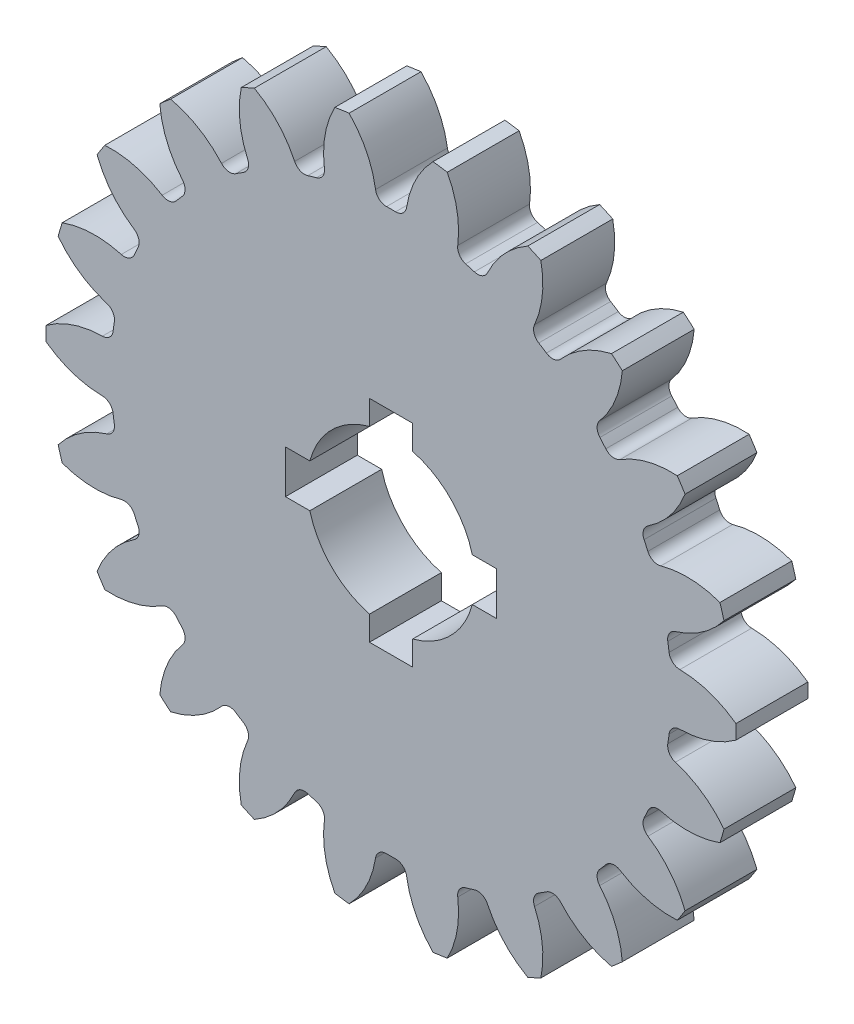
from build123d import *

# Parameters (mm, degrees)
SKETCH1_R                = 24
BOSS_EXTRUDE1_DEPTH      = 5
CUT_EXTRUDE1_DEPTH       = 10
FILLET2_R                = 0.76
CIRPATTERN2_COUNT        = 22
FILLET2_OF_CIRPATTERN2_R = 0.76
CUT_EXTRUDE2_DEPTH       = 5


with BuildPart() as part:
    # Sketch1 → Boss-Extrude1 (new body)
    with BuildSketch(Plane.XY):
        Circle(SKETCH1_R)
    extrude(amount=-BOSS_EXTRUDE1_DEPTH)

    # Sketch1<4> → Cut-Extrude1 (cut)
    with BuildSketch(Plane.XY):
        with BuildLine():
            ThreePointArc((-1.010850177, 19.473781911), (0, 19.5), (1.010850177, 19.473781911))
            ThreePointArc((1.010850177, 19.473781911), (1.567692055, 21.822368063), (2.919931026, 23.821712844))
            ThreePointArc((2.919931026, 23.821712844), (0, 24), (-2.919931026, 23.821712844))
            ThreePointArc((-2.919931026, 23.821712844), (-1.567692055, 21.822368063), (-1.010850177, 19.473781911))
        make_face()
    cut_extrude1 = extrude(amount=-CUT_EXTRUDE1_DEPTH, mode=Mode.SUBTRACT)

    # Fillet2
    fillet2_edges = [part.edges().sort_by_distance(p)[0] for p in [
        (1.010850177, 19.473781911, -2.5),
        (-1.010850177, 19.473781911, -2.5),
    ]]
    fillet(fillet2_edges, radius=FILLET2_R)

    # CirPattern2: Cut-Extrude1 ×22 about axis
    cirpattern2_axis = Axis((0, 0, 0), (0, 0, 1))
    for i in range(1, CIRPATTERN2_COUNT):
        add(cut_extrude1.rotate(cirpattern2_axis, i * 360 / CIRPATTERN2_COUNT), mode=Mode.SUBTRACT)

    # Fillet2 of CirPattern2
    fillet2_of_cirpattern2_edges = [part.edges().sort_by_distance(p)[0] for p in [
        (-4.516494727, 18.969746318, -2.5),
        (-6.456302011, 18.400167508, -2.5),
        (-9.677940089, 16.928894696, -2.5),
        (-11.378702654, 15.835880964, -2.5),
        (-14.055336302, 13.516564706, -2.5),
        (-15.379268479, 11.988665524, -2.5),
        (-17.294052757, 9.009203029, -2.5),
        (-18.133897436, 7.170199702, -2.5),
        (-19.131707911, 3.771969303, -2.5),
        (-19.41942587, 1.770846944, -2.5),
        (-19.41942587, -1.770846944, -2.5),
        (-19.131707911, -3.771969303, -2.5),
        (-18.133897436, -7.170199702, -2.5),
        (-17.294052757, -9.009203029, -2.5),
        (-15.379268479, -11.988665524, -2.5),
        (-14.055336302, -13.516564706, -2.5),
        (-11.378702654, -15.835880964, -2.5),
        (-9.677940089, -16.928894696, -2.5),
        (-6.456302011, -18.400167508, -2.5),
        (-4.516494727, -18.969746318, -2.5),
        (-1.010850177, -19.473781911, -2.5),
        (1.010850177, -19.473781911, -2.5),
        (4.516494727, -18.969746318, -2.5),
        (6.456302011, -18.400167508, -2.5),
        (9.677940089, -16.928894696, -2.5),
        (11.378702654, -15.835880964, -2.5),
        (14.055336302, -13.516564706, -2.5),
        (15.379268479, -11.988665524, -2.5),
        (17.294052757, -9.009203029, -2.5),
        (18.133897436, -7.170199702, -2.5),
        (19.131707911, -3.771969303, -2.5),
        (19.41942587, -1.770846944, -2.5),
        (19.41942587, 1.770846944, -2.5),
        (19.131707911, 3.771969303, -2.5),
        (18.133897436, 7.170199702, -2.5),
        (17.294052757, 9.009203029, -2.5),
        (15.379268479, 11.988665524, -2.5),
        (14.055336302, 13.516564706, -2.5),
        (11.378702654, 15.835880964, -2.5),
        (9.677940089, 16.928894696, -2.5),
        (6.456302011, 18.400167508, -2.5),
        (4.516494727, 18.969746318, -2.5),
    ]]
    fillet(fillet2_of_cirpattern2_edges, radius=FILLET2_OF_CIRPATTERN2_R)

    # Sketch2 → Cut-Extrude2 (cut)
    with BuildSketch(Plane.XY):
        with BuildLine():
            Line((-1.5, 5.652839314), (-1.5, 7.348469228))
            Line((-1.5, 7.348469228), (1.5, 7.348469228))
            Line((1.5, 7.348469228), (1.5, 5.652839314))
            ThreePointArc((1.5, 5.652839314), (4.135492251, 4.135492251), (5.652839314, 1.5))
            Line((5.652839314, 1.5), (7.348469228, 1.5))
            Line((7.348469228, 1.5), (7.348469228, -1.5))
            Line((7.348469228, -1.5), (5.652839314, -1.5))
            ThreePointArc((5.652839314, -1.5), (4.135492251, -4.135492251), (1.5, -5.652839314))
            Line((1.5, -5.652839314), (1.5, -7.348469228))
            Line((1.5, -7.348469228), (-1.5, -7.348469228))
            Line((-1.5, -7.348469228), (-1.5, -5.652839314))
            ThreePointArc((-1.5, -5.652839314), (-4.135492251, -4.135492251), (-5.652839314, -1.5))
            Line((-5.652839314, -1.5), (-7.348469228, -1.5))
            Line((-7.348469228, -1.5), (-7.348469228, 1.5))
            Line((-7.348469228, 1.5), (-5.652839314, 1.5))
            ThreePointArc((-5.652839314, 1.5), (-4.135492251, 4.135492251), (-1.5, 5.652839314))
        make_face()
    extrude(amount=-CUT_EXTRUDE2_DEPTH, mode=Mode.SUBTRACT)


solid = part.part
